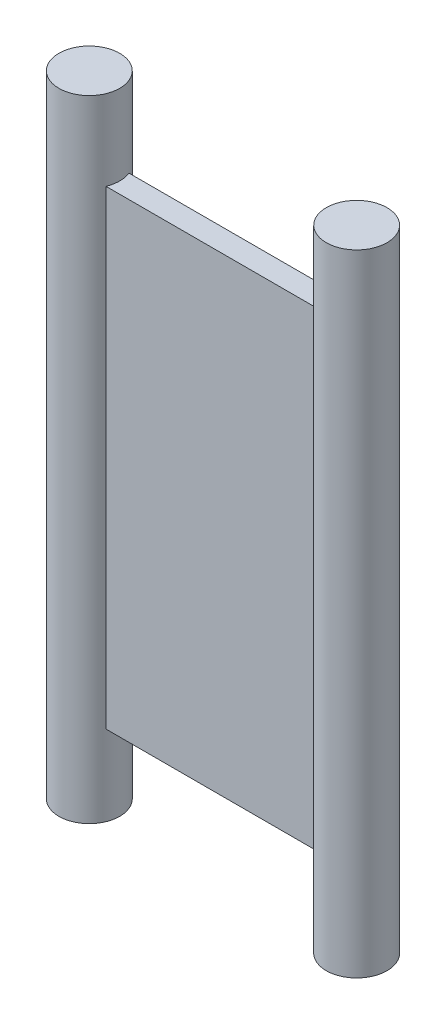
from build123d import *

# Parameters (mm, degrees)
SKETCH1_W           = 11.66
SKETCH1_H           = 1
BOSS_EXTRUDE1_DEPTH = 20.5
SKETCH2_R           = 1.325
BOSS_EXTRUDE2_DEPTH = 13.75


with BuildPart() as part:
    # Sketch1 → Boss-Extrude1 (new body)
    with BuildSketch(Plane(origin=(0, 0, 0), x_dir=(1, 0, 0), z_dir=(0, 1, 0))):
        Rectangle(SKETCH1_W, SKETCH1_H)
    extrude(amount=BOSS_EXTRUDE1_DEPTH)

    # Sketch2 → Boss-Extrude2 (add, symmetric)
    with BuildSketch(Plane(origin=(0, 10.25, 0), x_dir=(1, 0, 0), z_dir=(0, 1, 0))):
        with Locations(Location((-5.83, 0, 0), (0, 0, 270))):
            Circle(SKETCH2_R)
        with Locations(Location((5.83, 0, 0), (0, 0, 270))):
            Circle(SKETCH2_R)
    extrude(amount=BOSS_EXTRUDE2_DEPTH, both=True)


solid = part.part
